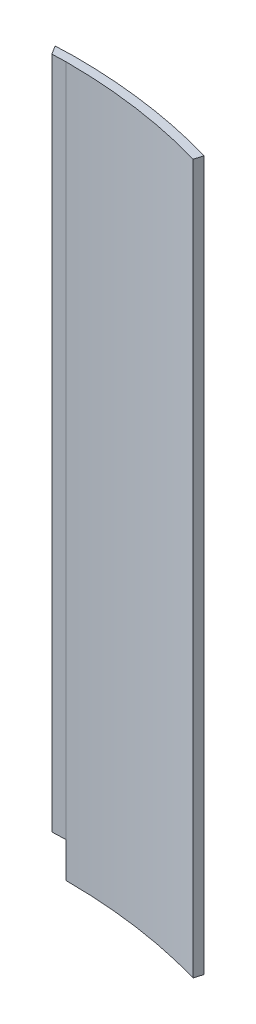
from build123d import *

# Parameters (mm, degrees)
EXTRUDE_1_DEPTH = 2000
EXTRUDE_2_DEPTH = 1900


with BuildPart() as part:
    # 草图1 → 凸台-拉伸1 (new body)
    with BuildSketch(Plane(origin=(0, 0, 0), x_dir=(1, 0, 0), z_dir=(0, 1, 0))):
        with BuildLine():
            Line((0, 1540), (0, 1515))
            ThreePointArc((0, 1515), (210.847247954, 1500.256124143), (417.590594063, 1456.311469347))
            Line((417.590594063, 1456.311469347), (424.481527958, 1480.343011745))
            ThreePointArc((424.481527958, 1480.343011745), (214.326575478, 1525.012825862), (0, 1540))
        make_face()
    extrude(amount=EXTRUDE_1_DEPTH)

    # 草图2 → 凸台-拉伸2 (add)
    with BuildSketch(Plane(origin=(0, 2000, 0), x_dir=(1, 0, 0), z_dir=(0, 1, 0))):
        Polygon((-38.424352084, 1513.658192058), (0, 1515), (0, 1540), (-53.712484783, 1538.1243187), align=None)
    extrude(amount=-EXTRUDE_2_DEPTH)


solid = part.part
